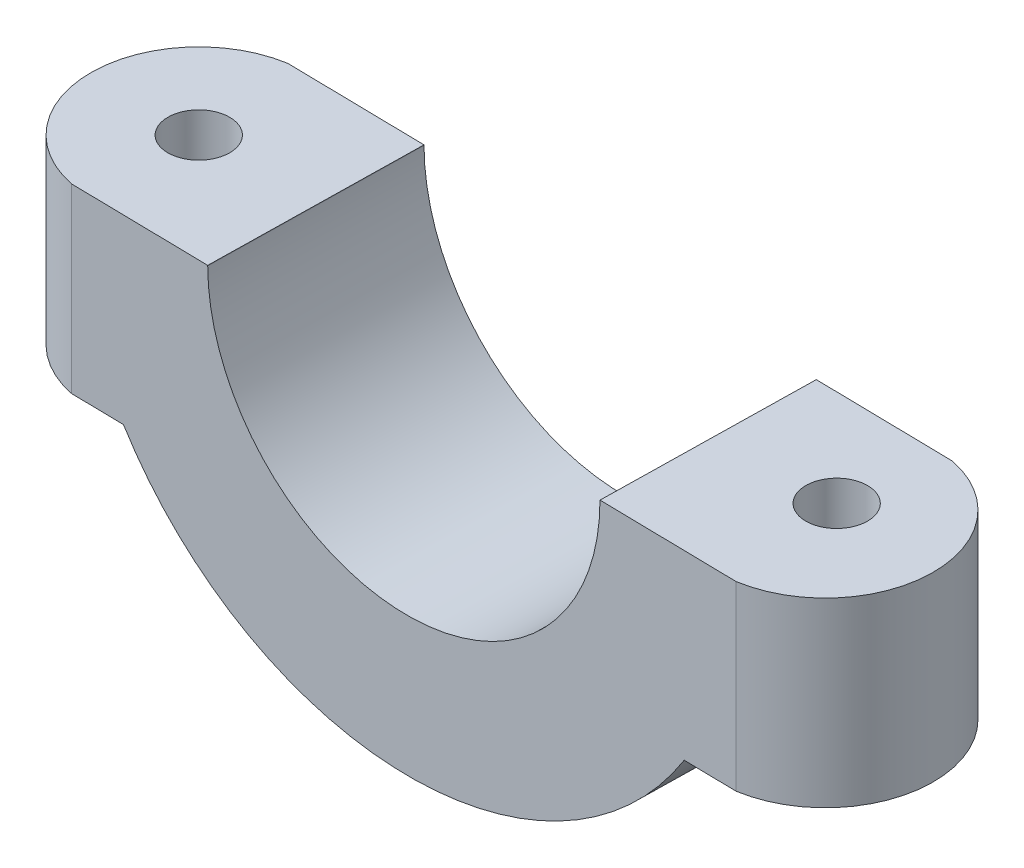
from build123d import *

# Parameters (mm, degrees)
EXTRUDE_1_DEPTH     = 10
EXTRUDE_1_2_DEPTH   = 10
EXTRUDE_3_DEPTH     = 11.703576761
SKETCH_5_R          = 1.7
CUT_EXTRUDE_1_DEPTH = 27.289015437
CUT_EXTRUDE_2_DEPTH = 2.4


with BuildPart() as part:
    # 草图1 → 凸台-拉伸1 (new body)
    with BuildSketch(Plane(origin=(0, 0, 0), x_dir=(1, 0, 0), z_dir=(0, 1, 0))):
        with BuildLine():
            Line((10.893392623, -6.049715663), (18.526323659, -6.186490707))
            ThreePointArc((18.526323659, -6.186490707), (23.511587835, -0.423094228), (18.736007239, 5.515207537))
            Line((18.736007239, 5.515207537), (11.103076203, 5.651982581))
            Line((11.103076203, 5.651982581), (10.893392623, -6.049715663))
        make_face()
    extrude(amount=EXTRUDE_1_DEPTH)



with BuildPart() as body_2:
    # 草图1 → Extrude 1 2 (new body)
    with BuildSketch(Plane(origin=(0, 0, 0), x_dir=(1, 0, 0), z_dir=(0, 1, 0))):
        with BuildLine():
            Line((-10.893392623, 6.046138902), (-18.526323659, 6.182913947))
            ThreePointArc((-18.526323659, 6.182913947), (-23.511587835, 0.419517467), (-18.736007239, -5.518784297))
            Line((-18.736007239, -5.518784297), (-11.103076203, -5.655559342))
            Line((-11.103076203, -5.655559342), (-10.893392623, 6.046138902))
        make_face()
    extrude(amount=EXTRUDE_1_2_DEPTH)


with BuildPart() as part_1:
    add(part.part)

    add(body_2.part)  # 凸台-拉伸3 merges body 2
    # 草图3 → 凸台-拉伸3 (add)
    with BuildSketch(Plane(origin=(-0.104873826, 0, 5.852636928), x_dir=(0.9998394920722602, 0, 0.017916196378829744), z_dir=(-0.017916196378829744, 0, 0.9998394920722602))):
        with BuildLine():
            Line((-11, 10), (-18.63418842, 10))
            ThreePointArc((-18.63418842, 10), (0, -8.63418842), (18.63418842, 10))
            Line((18.63418842, 10), (11, 10))
            ThreePointArc((11, 10), (0, -1), (-11, 10))
        make_face()
    extrude(amount=-EXTRUDE_3_DEPTH)

    # 草图5 → 切除-拉伸1 (cut, through all)
    with BuildSketch(Plane.XZ):
        with Locations(Location((-17.564258534, -0.312946842, 0), (0, 0, 270))):
            Circle(SKETCH_5_R)
        with Locations(Location((17.564258534, -0.312946842, 0), (0, 0, 90))):
            Circle(SKETCH_5_R)
    extrude(amount=-CUT_EXTRUDE_1_DEPTH, mode=Mode.SUBTRACT)

    # 草图6 → 切除-拉伸2 (cut, symmetric)
    with BuildSketch(Plane.XZ):
        Polygon((20.314258534, -1.900660082), (17.564258534, -3.488373323), (14.814258534, -1.900660082), (14.814258534, 1.274766398), (17.564258534, 2.862479638), (20.314258534, 1.274766398), align=None)
        Polygon((-17.564258534, -3.488373323), (-14.814258534, -1.900660082), (-14.814258534, 1.274766398), (-17.564258534, 2.862479638), (-20.314258534, 1.274766398), (-20.314258534, -1.900660082), align=None)
    extrude(amount=CUT_EXTRUDE_2_DEPTH, both=True, mode=Mode.SUBTRACT)


solid = part_1.part
